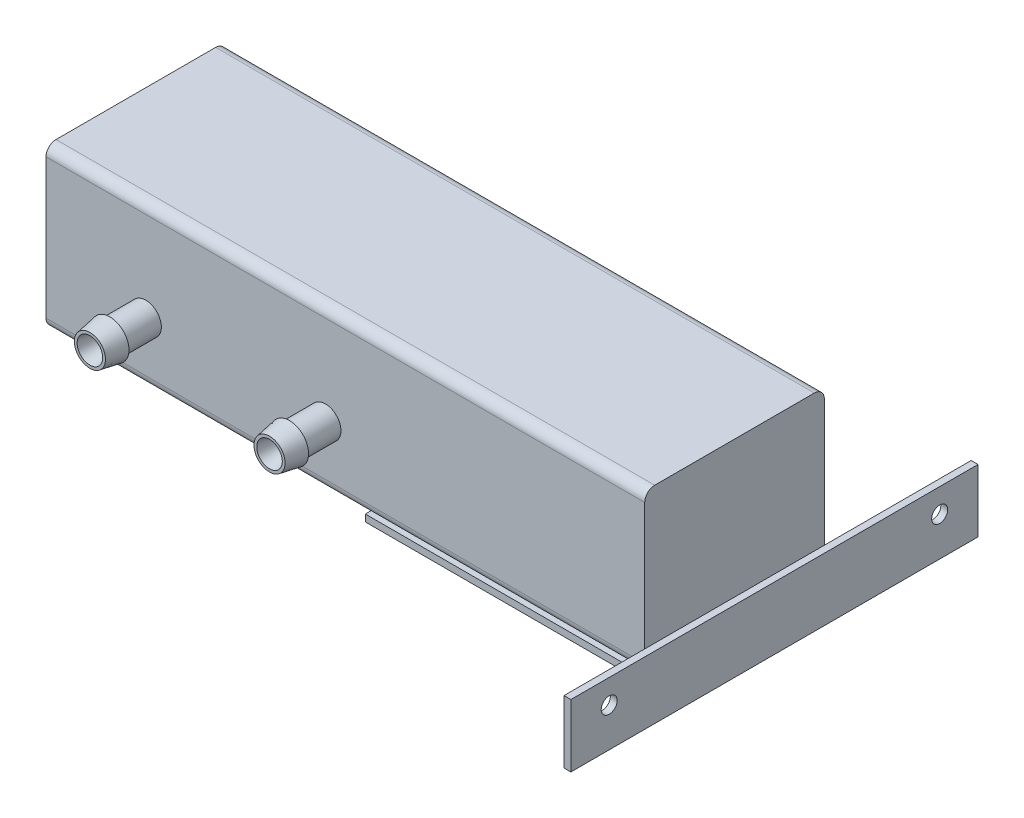
from build123d import *

# Parameters (mm, degrees)
SKETCH1_W                     = 190.5
SKETCH1_H                     = 50.8
BOSS_EXTRUDE1_DEPTH           = 28.575
SKETCH2_R                     = 4.953
SKETCH2_R_2                   = 4.064
BOSS_EXTRUDE2_DEPTH           = 17.78
SKETCH3_R                     = 4.953
SKETCH3_R_2                   = 4.064
BOSS_EXTRUDE3_DEPTH           = 6.35
BOSS_EXTRUDE3_DRAFT           = 10
BOSS_EXTRUDE3_PROFILE_2_DEPTH = 6.35
BOSS_EXTRUDE3_PROFILE_2_DRAFT = 10
BOSS_EXTRUDE4_DEPTH           = 57.15
SKETCH7_W                     = 2.188600317
SKETCH7_H                     = 19.968600317
BOSS_EXTRUDE5_DEPTH           = 64.77
SKETCH8_R                     = 2.54
CUT_EXTRUDE1_DEPTH            = 213.983254201
FILLET1_R                     = 3.175


with BuildPart() as part:
    # Sketch1 → Boss-Extrude1 (new, symmetric)
    with BuildSketch(Plane.XY):
        Rectangle(SKETCH1_W, SKETCH1_H)
    extrude(amount=BOSS_EXTRUDE1_DEPTH, both=True)

    # Sketch2 → Boss-Extrude2 (add)
    # profile 1 of 2: a face of its own
    with BuildSketch(Plane.XY.offset(28.575)):
        with Locations((-63.5, -6.35)):
            Circle(SKETCH2_R)
        with Locations((-63.5, -6.35)):
            Circle(SKETCH2_R_2, mode=Mode.SUBTRACT)
    # profile 2 of 2: a face of its own
    with BuildSketch(Plane.XY.offset(28.575)):
        with Locations((-6.35, -6.35)):
            Circle(SKETCH2_R)
        with Locations((-6.35, -6.35)):
            Circle(SKETCH2_R_2, mode=Mode.SUBTRACT)
    extrude(amount=BOSS_EXTRUDE2_DEPTH)


with BuildPart() as boss_extrude3_tool:
    # Sketch3 → Boss-Extrude3 (with draft: the straight prism first)
    with BuildSketch(Plane.XY.offset(46.355)):
        with Locations((-63.5, -6.35)):
            Circle(SKETCH3_R)
        with Locations((-63.5, -6.35)):
            Circle(SKETCH3_R_2, mode=Mode.SUBTRACT)
    extrude(amount=-BOSS_EXTRUDE3_DEPTH)
    # Boss-Extrude3: the draft: its side faces are tilted about the plane it starts from
    boss_extrude3_sides = [boss_extrude3_tool.faces().sort_by_distance(p)[0] for p in [
        (-68.453, -6.35, 43.18),
        (-67.564, -6.35, 43.18),
    ]]
    draft(boss_extrude3_sides, Plane.XY.offset(46.355), BOSS_EXTRUDE3_DRAFT)


with BuildPart() as part_1:
    add(part.part)

    # Boss-Extrude3: add boss_extrude3_tool
    add(boss_extrude3_tool.part)


with BuildPart() as boss_extrude3_profile_2_tool:
    # Sketch3 → Boss-Extrude3 profile 2 (with draft: the straight prism first)
    with BuildSketch(Plane.XY.offset(46.355)):
        with Locations((-6.35, -6.35)):
            Circle(SKETCH3_R)
        with Locations((-6.35, -6.35)):
            Circle(SKETCH3_R_2, mode=Mode.SUBTRACT)
    extrude(amount=-BOSS_EXTRUDE3_PROFILE_2_DEPTH)
    # Boss-Extrude3 profile 2: the draft: its side faces are tilted about the plane it starts from
    boss_extrude3_profile_2_sides = [boss_extrude3_profile_2_tool.faces().sort_by_distance(p)[0] for p in [
        (-11.303, -6.35, 43.18),
        (-10.414, -6.35, 43.18),
    ]]
    draft(boss_extrude3_profile_2_sides, Plane.XY.offset(46.355), BOSS_EXTRUDE3_PROFILE_2_DRAFT)


with BuildPart() as part_2:
    add(part_1.part)

    # Boss-Extrude3 profile 2: add boss_extrude3_profile_2_tool
    add(boss_extrude3_profile_2_tool.part)

    # Fillet1
    fillet1_edges = [part_2.edges().sort_by_distance(p)[0] for p in [
        (0, -25.4, 28.575),
        (0, -25.4, -28.575),
        (0, 25.4, -28.575),
        (0, 25.4, 28.575),
    ]]
    fillet(fillet1_edges, radius=FILLET1_R)


with BuildPart() as body_2:
    # Sketch5 → Boss-Extrude4 (new body)
    with BuildSketch(Plane.XY.offset(28.575)):
        Polygon((6.35, -25.4), (105.761399683, -25.4), (105.761399683, -7.62), (107.95, -7.62), (107.95, -25.4), (107.95, -27.588600317), (6.35, -27.588600317), align=None)
    extrude(amount=-BOSS_EXTRUDE4_DEPTH)

    # Sketch7 → Boss-Extrude5 (add, symmetric)
    with BuildSketch(Plane.XY):
        with Locations((106.855699842, -17.604300158)):
            Rectangle(SKETCH7_W, SKETCH7_H)
    extrude(amount=BOSS_EXTRUDE5_DEPTH, both=True)

    # Sketch8 → Cut-Extrude1 (cut, through all)
    with BuildSketch(Plane.ZY.offset(-105.761399683)):
        with Locations((52.578, -15.24)):
            Circle(SKETCH8_R)
        with Locations((-52.578, -15.24)):
            Circle(SKETCH8_R)
    extrude(amount=-CUT_EXTRUDE1_DEPTH, mode=Mode.SUBTRACT)


solid = Compound([part_2.part, body_2.part])
